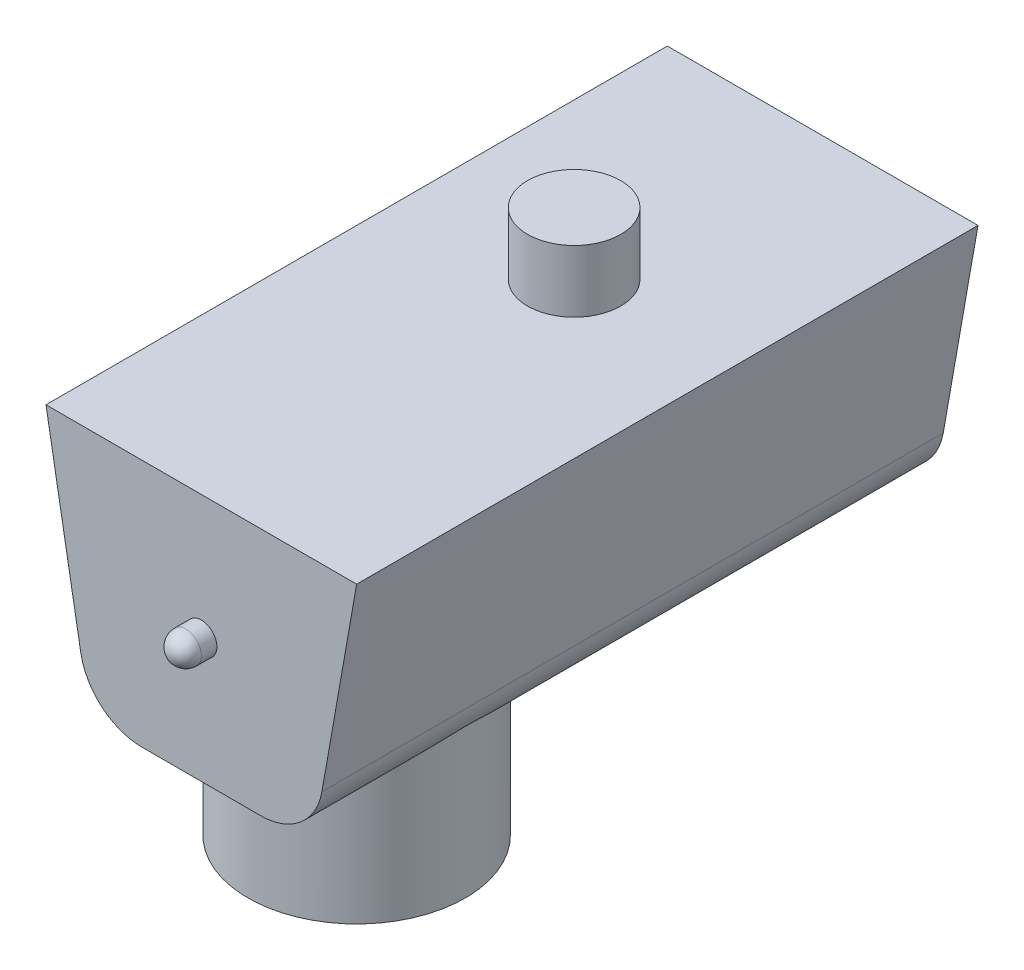
from build123d import *

# Parameters (mm, degrees)
SKETCH1_R                = 0.5
BOSS_EXTRUDE1_DEPTH      = 20
SKETCH1_2_R              = 0.5
BOSS_EXTRUDE2_DEPTH      = 1
FILLET1_R                = 0.5
BOSS_EXTRUDE3_DEPTH      = 4
BOSS_EXTRUDE3_DEPTH_BACK = 2
SKETCH2_R                = 3.5
SKETCH2_R_2              = 3
SKETCH3_R                = 1.5
BOSS_EXTRUDE4_DEPTH      = 2


with BuildPart() as part:
    # Sketch1 → Boss-Extrude1 (new body)
    with BuildSketch(Plane.XY):
        with BuildLine():
            Line((-5, 0), (5, 0))
            Line((5, 0), (3.880800398, -6.347296355))
            ThreePointArc((3.880800398, -6.347296355), (3.196760111, -7.532088886), (1.911184892, -8))
            Line((1.911184892, -8), (-1.911184892, -8))
            ThreePointArc((-1.911184892, -8), (-3.196760111, -7.532088886), (-3.880800398, -6.347296355))
            Line((-3.880800398, -6.347296355), (-5, 0))
        make_face()
        with Locations((0, -4)):
            Circle(SKETCH1_R, mode=Mode.SUBTRACT)
    extrude(amount=-BOSS_EXTRUDE1_DEPTH)

    # Sketch2 → Boss-Extrude3 (add, two sides: drawn at the far end of the back side and taken through both)
    with BuildSketch(Plane.XZ.offset(8).offset(-BOSS_EXTRUDE3_DEPTH_BACK)):
        with Locations((0, -5)):
            Circle(SKETCH2_R)
        with Locations((0, -5)):
            Circle(SKETCH2_R_2, mode=Mode.SUBTRACT)
    extrude(amount=BOSS_EXTRUDE3_DEPTH + BOSS_EXTRUDE3_DEPTH_BACK)

    # Sketch3 → Boss-Extrude4 (add)
    with BuildSketch(Plane(origin=(0, 0, 0), x_dir=(1, 0, 0), z_dir=(0, 1, 0))):
        with Locations((0, 12)):
            Circle(SKETCH3_R)
    extrude(amount=BOSS_EXTRUDE4_DEPTH)


with BuildPart() as body_2:
    # Sketch1<2> → Boss-Extrude2 (new body)
    with BuildSketch(Plane.XY):
        with Locations((0, -4)):
            Circle(SKETCH1_2_R)
    extrude(amount=BOSS_EXTRUDE2_DEPTH)

    # Fillet1
    fillet1_edges = [body_2.edges().sort_by_distance(p)[0] for p in [
        (-0.5, -4, 1),
    ]]
    fillet(fillet1_edges, radius=FILLET1_R)


solid = Compound([part.part, body_2.part])
